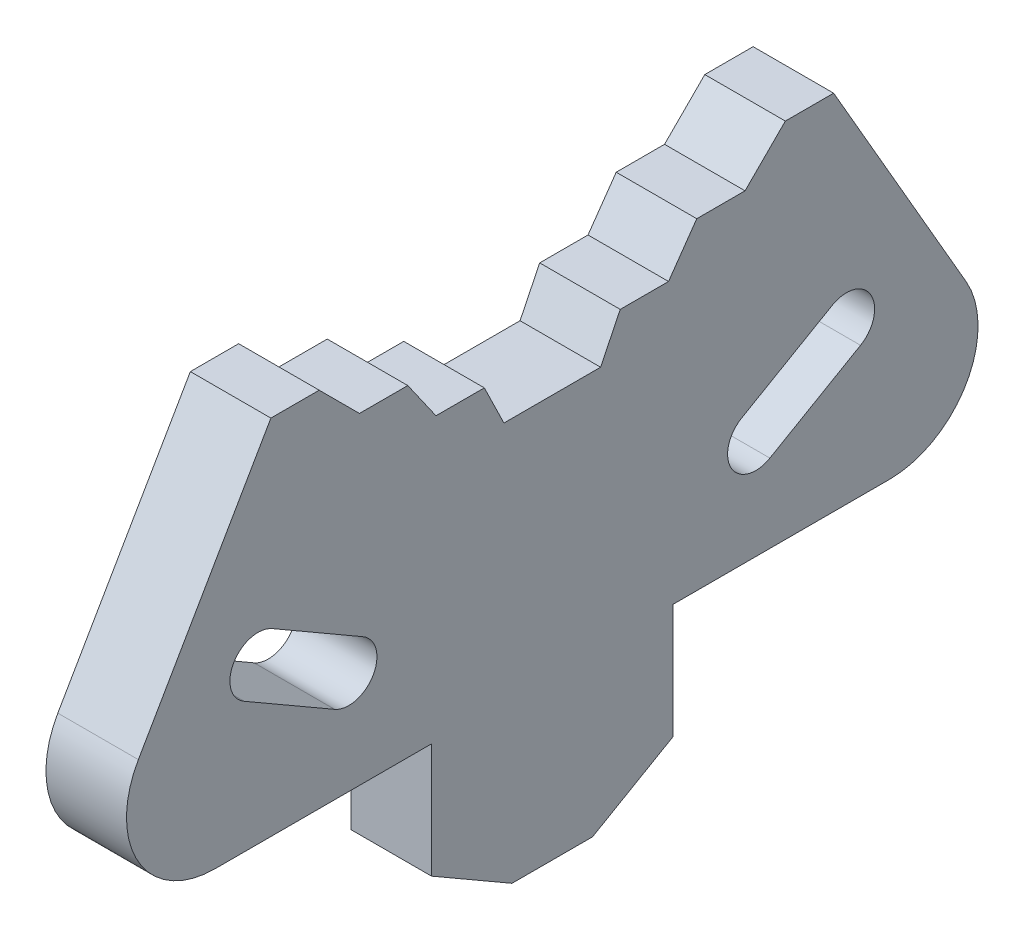
from build123d import *

# Parameters (mm, degrees)
EXTRUDE_1_DEPTH = 10
SKETCH_2_W      = 30
SKETCH_2_H      = 20
EXTRUDE_2_DEPTH = 10
CHAMFER_1_SIZE  = 10
CHAMFER_1_SIZE2 = 5.773502692
CHAMFER_2_SIZE  = 10
CHAMFER_2_SIZE2 = 5.773502692


with BuildPart() as part:
    # Эскиз1 → Бобышка-Вытянуть1 (new body)
    with BuildSketch(Plane(origin=(0, 0, 0), x_dir=(0, 0, -1), z_dir=(1, 0, 0))):
        with BuildLine():
            Line((0, 0), (41.867903864, 0))
            ThreePointArc((41.867903864, 0), (51.394183306, 5.5), (51.394183306, 16.5))
            Line((51.394183306, 16.5), (34.939700634, 45))
            Line((34.939700634, 45), (28.939700634, 45))
            Line((28.939700634, 45), (23.939700634, 40))
            Line((23.939700634, 40), (17.939700634, 40))
            Line((17.939700634, 40), (14.438662943, 35))
            Line((14.438662943, 35), (8.438662943, 35))
            Line((8.438662943, 35), (6, 30))
            Line((6, 30), (0, 30))
            Line((0, 30), (0, 0))
        make_face()
        with BuildLine():
            Line((23.519083625, 15.781088913), (34.777413874, 22.281088913))
            ThreePointArc((34.777413874, 22.281088913), (39.558502787, 21), (38.277413874, 16.218911087))
            Line((38.277413874, 16.218911087), (27.019083625, 9.718911087))
            ThreePointArc((27.019083625, 9.718911087), (22.237994712, 11), (23.519083625, 15.781088913))
        make_face(mode=Mode.SUBTRACT)
    extrude(amount=EXTRUDE_1_DEPTH)

    # Зеркальное отражение1: part across plane


with BuildPart() as part_1:
    add(part.part)
    add(part.part.mirror(Plane(origin=(10, 30, 0), x_dir=(1, 0, 0), z_dir=(0, 0, -1))))

    # Эскиз2 → Бобышка-Вытянуть2 (add)
    with BuildSketch(Plane(origin=(10, 0, 0), x_dir=(0, 0, -1), z_dir=(1, 0, 0))):
        with Locations((0, -10)):
            Rectangle(SKETCH_2_W, SKETCH_2_H)
    extrude(amount=-EXTRUDE_2_DEPTH)

    # Фаска1
    chamfer_1_edges = [part_1.edges().sort_by_distance(p)[0] for p in [
        (5, -20, 15),
    ]]
    chamfer_1_side = [part_1.faces().sort_by_distance(p)[0] for p in [
        (5, -20, 0),
    ]]
    chamfer(chamfer_1_edges, length=CHAMFER_1_SIZE, length2=CHAMFER_1_SIZE2, reference=chamfer_1_side[0])

    # Фаска2
    chamfer_2_edges = [part_1.edges().sort_by_distance(p)[0] for p in [
        (5, -20, -15),
    ]]
    chamfer_2_side = [part_1.faces().sort_by_distance(p)[0] for p in [
        (5, -20, -5),
    ]]
    chamfer(chamfer_2_edges, length=CHAMFER_2_SIZE, length2=CHAMFER_2_SIZE2, reference=chamfer_2_side[0])


solid = part_1.part
